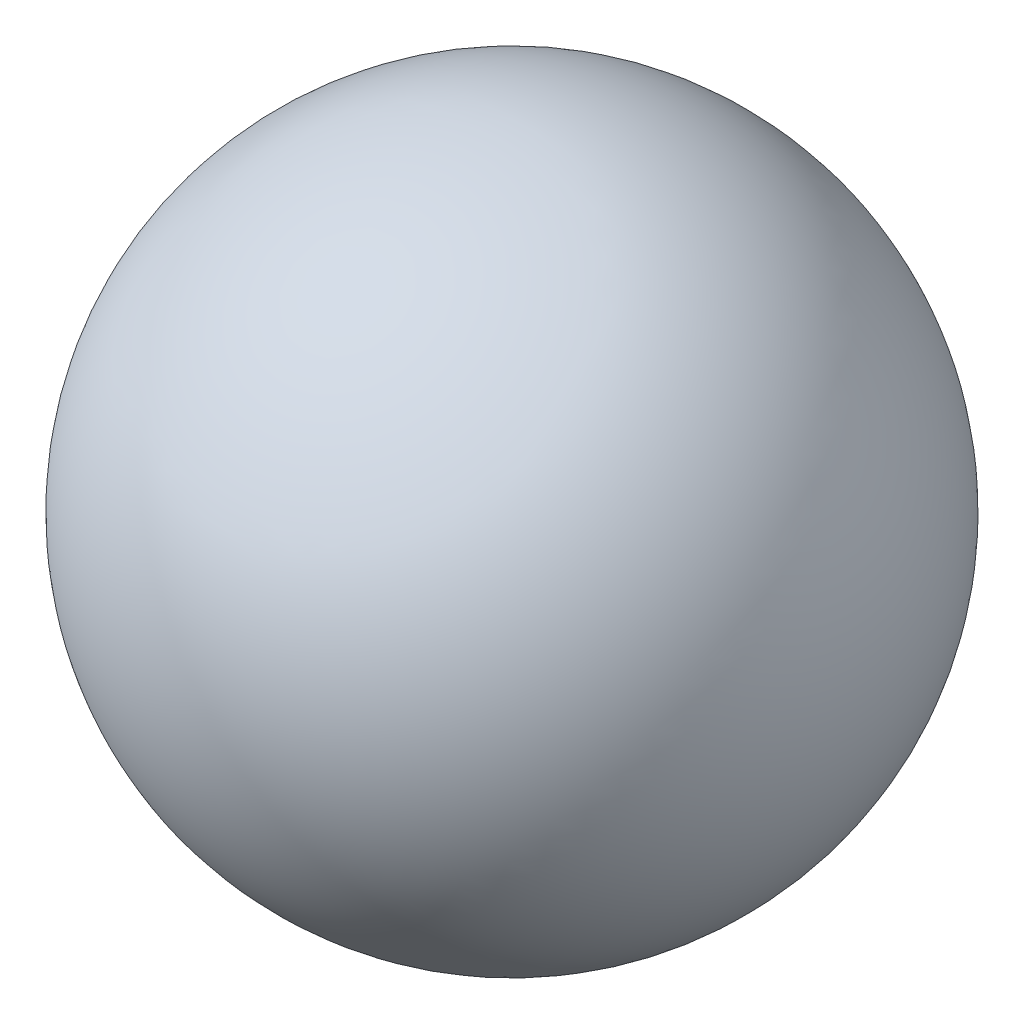
from build123d import *


with BuildPart() as part:
    # Sketch2 → Revolve1 (revolve)
    with BuildSketch(Plane(origin=(0, 0, 0), x_dir=(1, 0, 0), z_dir=(0, 1, 0))):
        with BuildLine():
            Line((0, 19.939), (0, -19.939))
            ThreePointArc((0, -19.939), (-19.939, 0), (0, 19.939))
        make_face()
    revolve(axis=Axis((0, 0, -19.939), (0, 0, 1)))


solid = part.part
